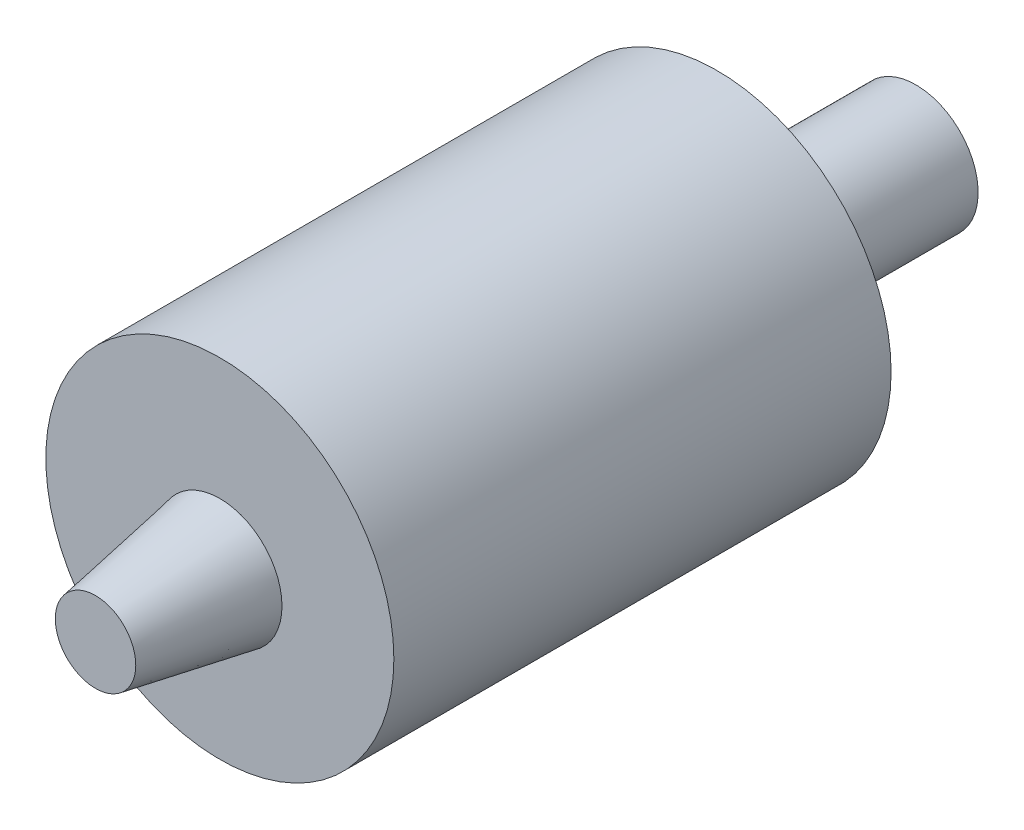
from build123d import *

# Parameters (mm, degrees)
SKIZZE1_R                       = 14
AUFSATZ_LINEAR_AUSTRAGEN1_DEPTH = 40
SKIZZE2_R                       = 5
AUFSATZ_LINEAR_AUSTRAGEN2_DEPTH = 16
SKIZZE3_R                       = 5
AUFSATZ_LINEAR_AUSTRAGEN3_DEPTH = 10
AUFSATZ_LINEAR_AUSTRAGEN3_TAPER = 10


with BuildPart() as part:
    # Skizze1 → Aufsatz-Linear austragen1 (new body)
    with BuildSketch(Plane.XY):
        Circle(SKIZZE1_R)
    extrude(amount=AUFSATZ_LINEAR_AUSTRAGEN1_DEPTH)

    # Skizze2 → Aufsatz-Linear austragen2 (add)
    with BuildSketch(Plane(origin=(0, 0, 0), x_dir=(-1, 0, 0), z_dir=(0, 0, -1))):
        Circle(SKIZZE2_R)
    extrude(amount=AUFSATZ_LINEAR_AUSTRAGEN2_DEPTH)

    # Skizze3 → Aufsatz-Linear austragen3 (add)
    with BuildSketch(Plane.XY.offset(40)):
        with Locations((0, -0.81713022)):
            Circle(SKIZZE3_R)
    extrude(amount=AUFSATZ_LINEAR_AUSTRAGEN3_DEPTH, taper=AUFSATZ_LINEAR_AUSTRAGEN3_TAPER)


solid = part.part
